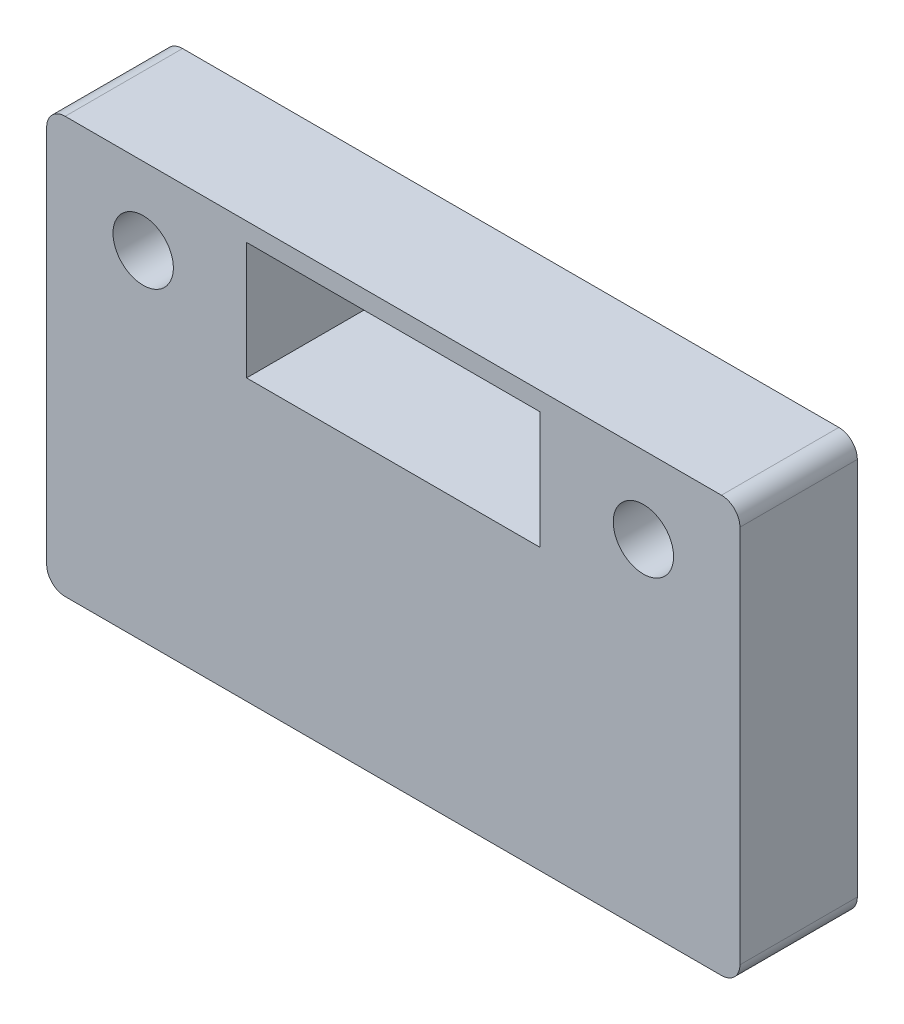
from build123d import *

# Parameters (mm, degrees)
SKETCH1_W                                        = 75
SKETCH1_H                                        = 45
BOSS_EXTRUDE1_DEPTH                              = 12.7
CSK_FOR_1_4_FLAT_HEAD_MACHINE_SCREW2_D           = 6.5278
CSK_FOR_1_4_FLAT_HEAD_MACHINE_SCREW2_CSINK_D     = 12.8778
CSK_FOR_1_4_FLAT_HEAD_MACHINE_SCREW2_CSINK_ANGLE = 82
FILLET1_R                                        = 2
FILLET2_R                                        = 2


with BuildPart() as part:
    # Sketch1 → Boss-Extrude1 (new body)
    with BuildSketch(Plane.XY):
        with Locations((37.5, -22.5)):
            Rectangle(SKETCH1_W, SKETCH1_H)
        Polygon((37.5, -2), (53.375, -2), (53.375, -14.7), (21.625, -14.7), (21.625, -2), align=None, mode=Mode.SUBTRACT)
    extrude(amount=BOSS_EXTRUDE1_DEPTH)

    # CSK for 1/4 Flat Head Machine Screw2 (through all)
    with Locations(Plane(origin=(0, 0, 0), x_dir=(-1, 0, 0), z_dir=(0, 0, -1))):
        with Locations((-64.56, -8.35), (-10.44, -8.35)):
            CounterSinkHole(CSK_FOR_1_4_FLAT_HEAD_MACHINE_SCREW2_D / 2, CSK_FOR_1_4_FLAT_HEAD_MACHINE_SCREW2_CSINK_D / 2, counter_sink_angle=CSK_FOR_1_4_FLAT_HEAD_MACHINE_SCREW2_CSINK_ANGLE)

    # Fillet1
    fillet1_edges = [part.edges().sort_by_distance(p)[0] for p in [
        (0, 0, 6.35),
        (0, -45, 6.35),
    ]]
    fillet(fillet1_edges, radius=FILLET1_R)

    # Fillet2
    fillet2_edges = [part.edges().sort_by_distance(p)[0] for p in [
        (75, 0, 6.35),
        (75, -45, 6.35),
    ]]
    fillet(fillet2_edges, radius=FILLET2_R)


solid = part.part
